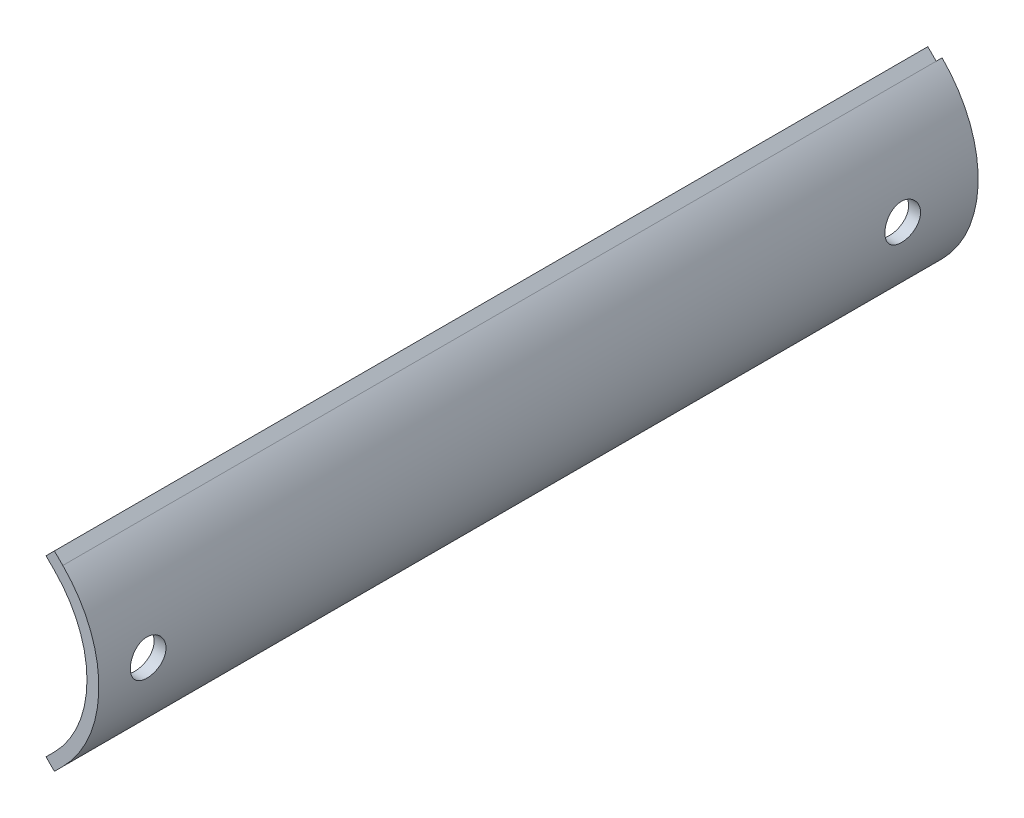
from build123d import *

# Parameters (mm, degrees)
EXTRUDE1_DEPTH     = 74
SKETCH8_R          = 1.5
CUT_EXTRUDE4_DEPTH = 76.079920085
SKETCH9_W          = 74
SKETCH9_H          = 1
EXTRUDE2_DEPTH     = 1
SKETCH10_W         = 1
SKETCH10_H         = 74
EXTRUDE3_DEPTH     = 1
SKETCH12_W         = 0.495242112
SKETCH12_H         = 1
CUT_EXTRUDE5_DEPTH = 1
SKETCH13_W         = 1
SKETCH13_H         = 0.498210359
CUT_EXTRUDE6_DEPTH = 1


with BuildPart() as part:
    # Sketch1 → Extrude1 (new body)
    with BuildSketch(Plane.XY):
        with BuildLine():
            Line((6.618519472, 6.618519472), (7.325626253, 7.325626253))
            ThreePointArc((7.325626253, 7.325626253), (10.36, 0), (7.325626253, -7.325626253))
            Line((7.325626253, -7.325626253), (6.618519472, -6.618519472))
            ThreePointArc((6.618519472, -6.618519472), (9.36, 0), (6.618519472, 6.618519472))
        make_face()
    extrude(amount=EXTRUDE1_DEPTH)

    # Sketch8 → Cut-Extrude4 (cut, through all)
    with BuildSketch(Plane(origin=(0, 0, 0), x_dir=(0, 0, -1), z_dir=(1, 0, 0))):
        with Locations(Location((-6.35, 0, 0), (0, 0, 180))):
            Circle(SKETCH8_R)
        with Locations(Location((-69.85, 0, 0), (0, 0, 180))):
            Circle(SKETCH8_R)
    extrude(amount=CUT_EXTRUDE4_DEPTH, mode=Mode.SUBTRACT)

    # Sketch9 → Extrude2 (add)
    with BuildSketch(Plane(origin=(0, 0, 0), x_dir=(0, 0, 1), z_dir=(-0.7071067811865479, 0.7071067811865472, 0))):
        with Locations((37, 9.86)):
            Rectangle(SKETCH9_W, SKETCH9_H)
    extrude(amount=EXTRUDE2_DEPTH)

    # Sketch10 → Extrude3 (add)
    with BuildSketch(Plane(origin=(0, 0, 0), x_dir=(0.7071067811865475, -0.7071067811865477, 0), z_dir=(-0.7071067811865477, -0.7071067811865475, 0))):
        with Locations((9.86, 37)):
            Rectangle(SKETCH10_W, SKETCH10_H)
    extrude(amount=EXTRUDE3_DEPTH)

    # Sketch12 → Cut-Extrude5 (cut)
    with BuildSketch(Plane(origin=(-0.7071067811865468, 0.7071067811865459, 0), x_dir=(0, 0, 1), z_dir=(-0.7071067811865479, 0.7071067811865472, 0))):
        with Locations((0.247621056, 9.86)):
            Rectangle(SKETCH12_W, SKETCH12_H)
    extrude(amount=-CUT_EXTRUDE5_DEPTH, mode=Mode.SUBTRACT)

    # Sketch13 → Cut-Extrude6 (cut)
    with BuildSketch(Plane(origin=(6.618519472, -6.618519472, 0), x_dir=(-0.7071067811865476, -0.7071067811865476, 0), z_dir=(-0.7071067811865476, 0.7071067811865476, 0))):
        with Locations((0.5, 0.24910518)):
            Rectangle(SKETCH13_W, SKETCH13_H)
    extrude(amount=-CUT_EXTRUDE6_DEPTH, mode=Mode.SUBTRACT)


solid = part.part
